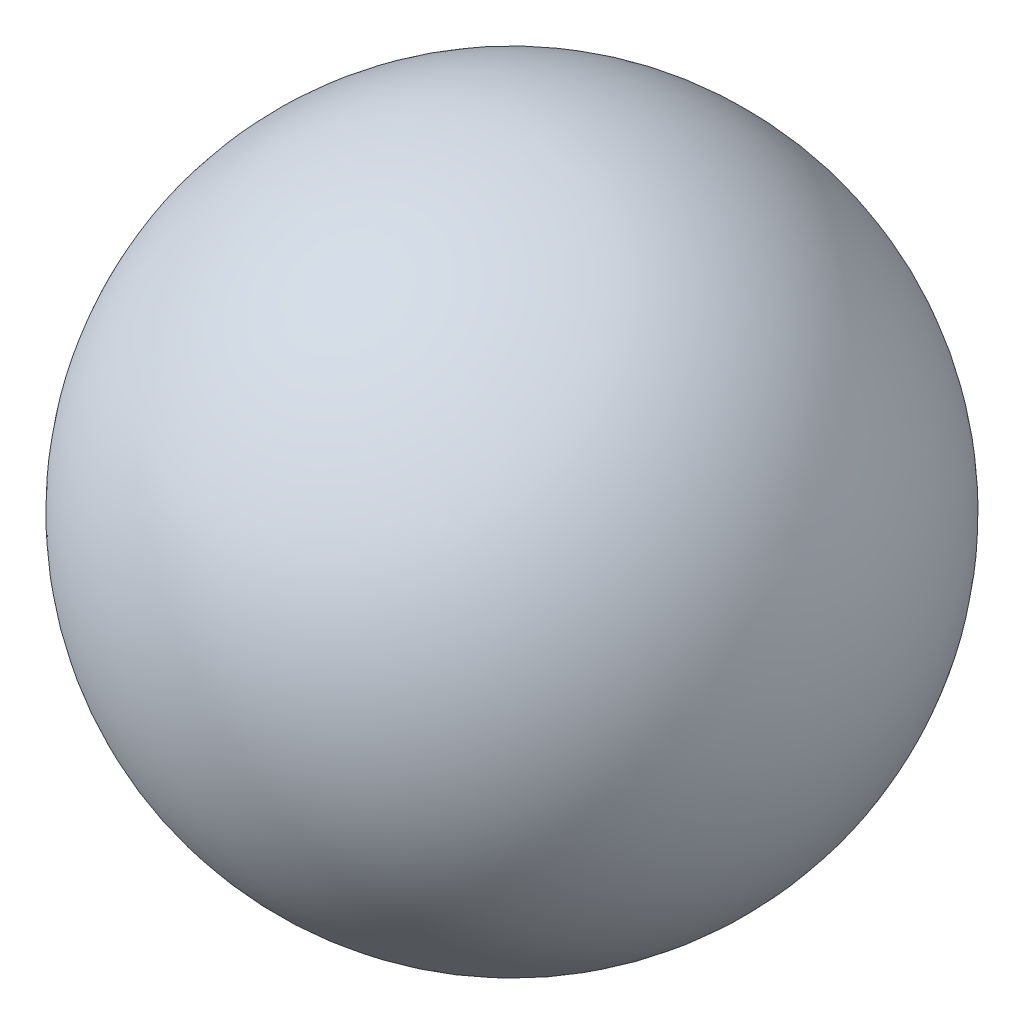
from build123d import *


with BuildPart() as part:
    # Sketch1 → Revolve1 (revolve)
    with BuildSketch(Plane.XY):
        with BuildLine():
            Line((3.6905, 4.75), (1.3095, 4.75))
            ThreePointArc((1.3095, 4.75), (2.5, 5.9405), (3.6905, 4.75))
        make_face()
    revolve(axis=Axis((3.6905, 4.75, 0), (-1, 0, 0)))


solid = part.part
